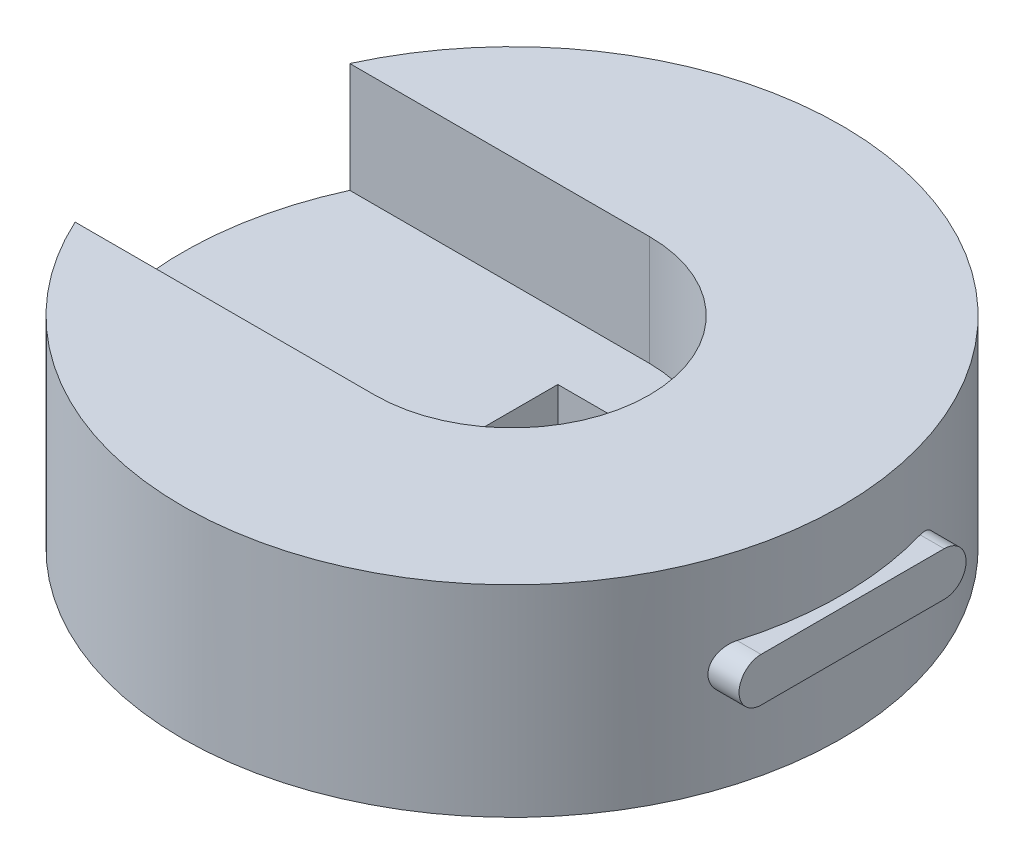
from build123d import *

# Parameters (mm, degrees)
SKETCH2_R           = 90
BOSS_EXTRUDE1_DEPTH = 55
CUT_EXTRUDE1_DEPTH  = 30
SKETCH4_W           = 15
SKETCH4_H           = 40
CUT_EXTRUDE2_DEPTH  = 131.766968306
BOSS_EXTRUDE2_DEPTH = 43


with BuildPart() as part:
    # Sketch2 → Boss-Extrude1 (new body)
    with BuildSketch(Plane(origin=(0, 0, 0), x_dir=(1, 0, 0), z_dir=(0, 1, 0))):
        Circle(SKETCH2_R)
    extrude(amount=BOSS_EXTRUDE1_DEPTH)

    # Sketch3 → Cut-Extrude1 (cut)
    with BuildSketch(Plane(origin=(0, 55, 0), x_dir=(1, 0, 0), z_dir=(0, 1, 0))):
        with BuildLine():
            Line((-144.325071801, 37.5), (0, 37.5))
            ThreePointArc((0, 37.5), (37.5, 0), (0, -37.5))
            Line((0, -37.5), (-144.325071801, -37.5))
            ThreePointArc((-144.325071801, -37.5), (-181.825071801, 0), (-144.325071801, 37.5))
        make_face()
    extrude(amount=-CUT_EXTRUDE1_DEPTH, mode=Mode.SUBTRACT)

    # Sketch4 → Cut-Extrude2 (cut, through all)
    with BuildSketch(Plane(origin=(0, 25, 0), x_dir=(1, 0, 0), z_dir=(0, 1, 0))):
        Rectangle(SKETCH4_W, SKETCH4_H)
    extrude(amount=-CUT_EXTRUDE2_DEPTH, mode=Mode.SUBTRACT)

    # Sketch6<4> → Boss-Extrude2 (add)
    with BuildSketch(Plane(origin=(50, 0, 0), x_dir=(0, 0, -1), z_dir=(1, 0, 0))):
        with BuildLine():
            Line((-25, 33.917885912), (25, 33.917885912))
            ThreePointArc((25, 33.917885912), (30.997040934, 27.920844978), (25, 21.923804044))
            Line((25, 21.923804044), (-25, 21.923804044))
            ThreePointArc((-25, 21.923804044), (-30.997040934, 27.920844978), (-25, 33.917885912))
        make_face()
    extrude(amount=BOSS_EXTRUDE2_DEPTH)


solid = part.part
